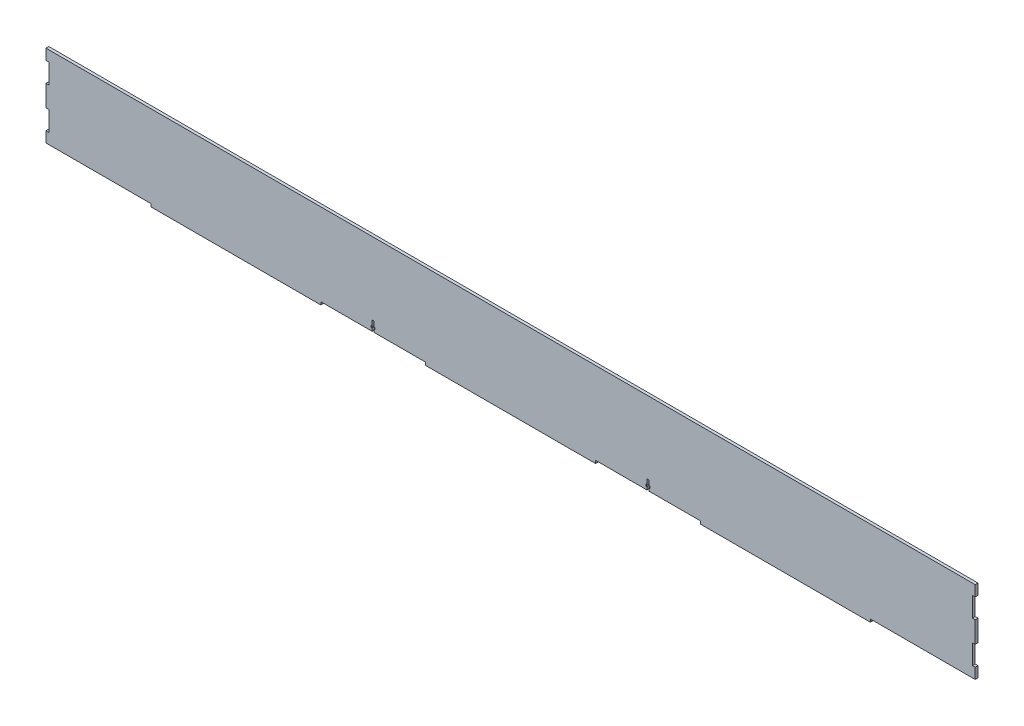
from build123d import *

# Parameters (mm, degrees)
SALIENTE_EXTRUIR1_DEPTH = 5
CROQUIS2_W              = 5
CROQUIS2_H              = 35
CORTAR_EXTRUIR1_DEPTH   = 5
CORTAR_EXTRUIR2_DEPTH   = 10


with BuildPart() as part:
    # Croquis1 → Saliente-Extruir1 (new body)
    with BuildSketch(Plane.XY):
        Polygon((0, 145), (0, 0), (183.734642654, 0), (185, 0), (185, -5), (485, -5), (485, 0), (670, 0), (670, -5), (970, -5), (970, 0), (1155, 0), (1155, -5), (1455, -5), (1455, 0), (1640, 0), (1640, 145), align=None)
    extrude(amount=SALIENTE_EXTRUIR1_DEPTH)

    # Croquis2 → Cortar-Extruir1 (cut)
    with BuildSketch(Plane.XY.offset(5)):
        with Locations((1637.5, 108.75)):
            Rectangle(CROQUIS2_W, CROQUIS2_H)
        with Locations((1637.5, 36.25)):
            Rectangle(CROQUIS2_W, CROQUIS2_H)
        with Locations((2.5, 36.25)):
            Rectangle(CROQUIS2_W, CROQUIS2_H)
        with Locations((2.5, 108.75)):
            Rectangle(CROQUIS2_W, CROQUIS2_H)
    extrude(amount=-CORTAR_EXTRUIR1_DEPTH, mode=Mode.SUBTRACT)

    # Croquis3 → Cortar-Extruir2 (cut)
    with BuildSketch(Plane.XY.offset(5)):
        Polygon((579.3, 0), (575.7, 0), (575.7, 5), (573.9, 5), (573.9, 8.2), (575.7, 8.2), (575.7, 17.2), (579.3, 17.2), (579.3, 8.2), (581.1, 8.2), (581.1, 5), (579.3, 5), align=None)
        Polygon((1064.3, 8.2), (1064.3, 17.2), (1060.7, 17.2), (1060.7, 8.2), (1058.9, 8.2), (1058.9, 5), (1060.7, 5), (1060.7, 0), (1064.3, 0), (1064.3, 5), (1066.1, 5), (1066.1, 8.2), align=None)
    extrude(amount=-CORTAR_EXTRUIR2_DEPTH, mode=Mode.SUBTRACT)


solid = part.part
